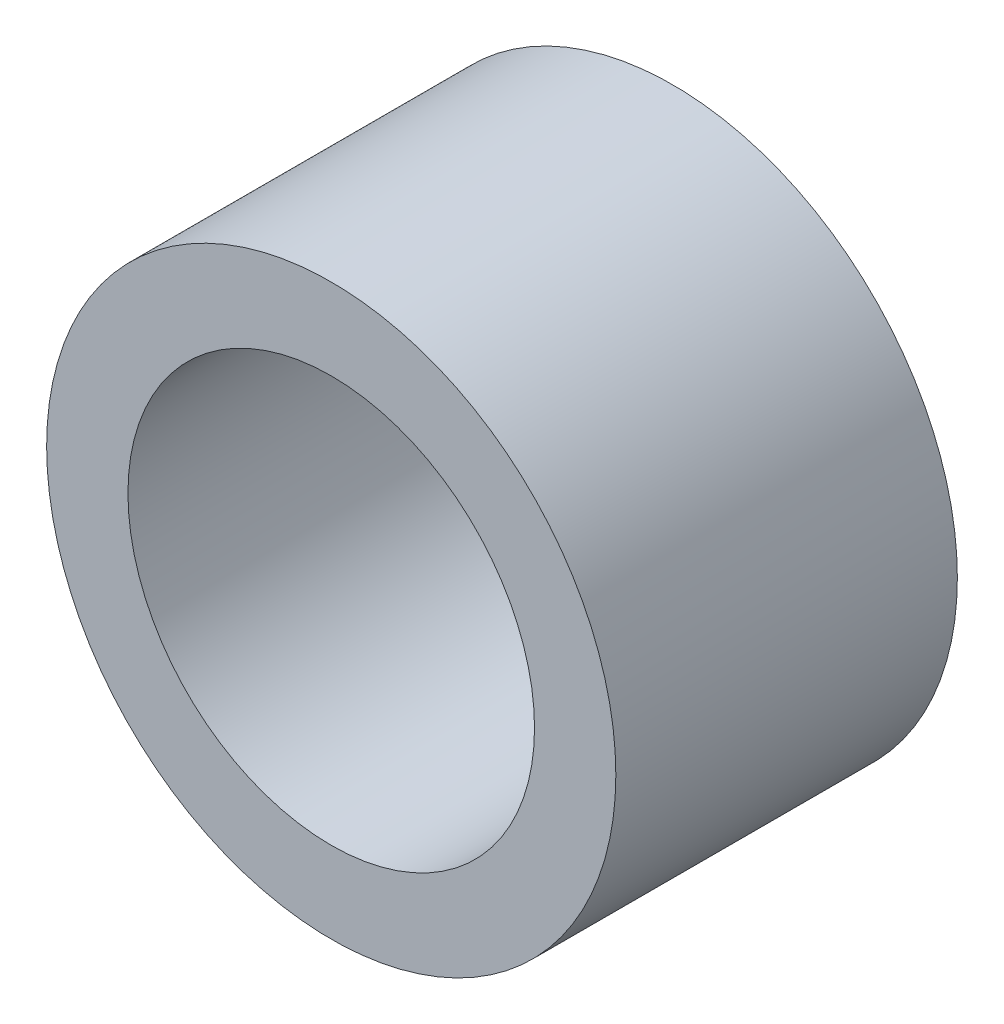
from build123d import *

# Parameters (mm, degrees)
SKETCH1_R           = 17.5
SKETCH1_R_2         = 12.5
BOSS_EXTRUDE1_DEPTH = 21


with BuildPart() as part:
    # Sketch1 → Boss-Extrude1 (new body)
    with BuildSketch(Plane.XY):
        with Locations(Location((0, 0, 0), (0, 0, 180))):
            Circle(SKETCH1_R)
        with Locations(Location((0, 0, 0), (0, 0, 180))):
            Circle(SKETCH1_R_2, mode=Mode.SUBTRACT)
    extrude(amount=BOSS_EXTRUDE1_DEPTH)


solid = part.part
